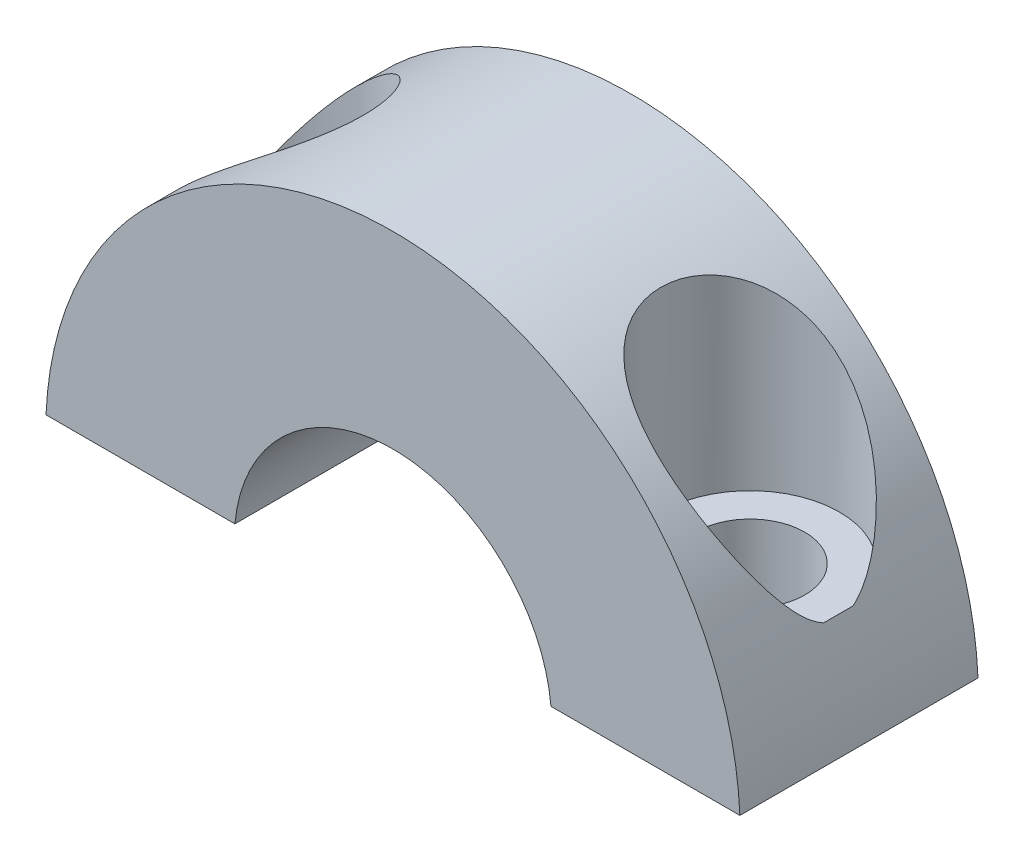
from build123d import *

# Parameters (mm, degrees)
EXTRUDE_1_DEPTH     = 6
SKETCH_2_R          = 2.75
CUT_EXTRUDE_1_DEPTH = 25.944939367
CUT_EXTRUDE_START   = 6
SKETCH_3_R          = 4.5
CUT_EXTRUDE_2_DEPTH = 20.454616638


with BuildPart() as part:
    # 草图1 → 凸台-拉伸1 (new, symmetric)
    with BuildSketch(Plane.XY):
        with BuildLine():
            Line((-17.483921185, 0.75), (-7.964766161, 0.75))
            ThreePointArc((-7.964766161, 0.75), (0, 8), (7.964766161, 0.75))
            Line((7.964766161, 0.75), (17.483921185, 0.75))
            ThreePointArc((17.483921185, 0.75), (0, 17.5), (-17.483921185, 0.75))
        make_face()
    extrude(amount=EXTRUDE_1_DEPTH, both=True)

    # 草图2 → 切除-拉伸1 (cut, through all)
    with BuildSketch(Plane.XZ.offset(-0.75)):
        with Locations(Location((-12, 0, 0), (0, 0, 270))):
            Circle(SKETCH_2_R)
    cut_extrude_1 = extrude(amount=-CUT_EXTRUDE_1_DEPTH, mode=Mode.SUBTRACT)

    # 草图3 → 切除-拉伸2 (cut, through all)
    with BuildSketch(Plane(origin=(0, 0, 0), x_dir=(1, 0, 0), z_dir=(0, 1, 0)).offset(CUT_EXTRUDE_START)):
        with Locations((-12, 0)):
            Circle(SKETCH_3_R)
    cut_extrude_2 = extrude(amount=CUT_EXTRUDE_2_DEPTH, mode=Mode.SUBTRACT)

    # 镜向1: 切除-拉伸1, 切除-拉伸2 across plane
    add(cut_extrude_1.mirror(Plane(origin=(0, 0, 0), x_dir=(0, 0, 1), z_dir=(1, 0, 0))), mode=Mode.SUBTRACT)
    add(cut_extrude_2.mirror(Plane(origin=(0, 0, 0), x_dir=(0, 0, 1), z_dir=(1, 0, 0))), mode=Mode.SUBTRACT)


solid = part.part
